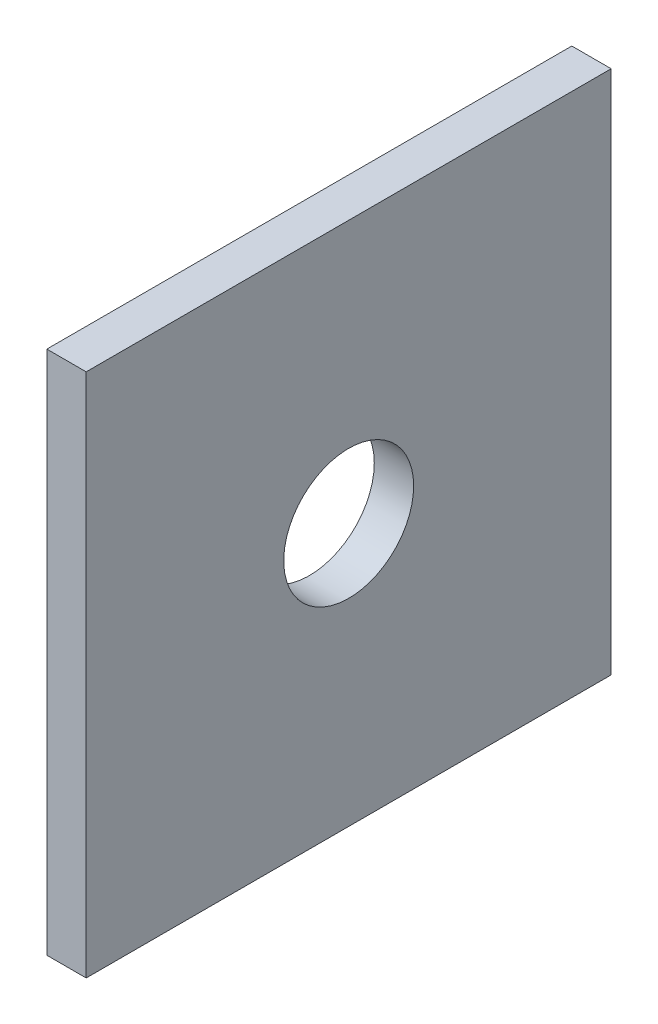
from build123d import *

# Parameters (mm, degrees)
SKETCH2_W           = 40
SKETCH2_H           = 40
BOSS_EXTRUDE1_DEPTH = 3
SKETCH3_R           = 4.95
CUT_EXTRUDE1_DEPTH  = 3


with BuildPart() as part:
    # Sketch2 → Boss-Extrude1 (new body)
    with BuildSketch(Plane(origin=(0, 0, 0), x_dir=(0, 0, -1), z_dir=(1, 0, 0))):
        Rectangle(SKETCH2_W, SKETCH2_H)
    extrude(amount=BOSS_EXTRUDE1_DEPTH)

    # Sketch3 → Cut-Extrude1 (cut)
    with BuildSketch(Plane(origin=(3, 0, 0), x_dir=(0, 0, -1), z_dir=(1, 0, 0))):
        Circle(SKETCH3_R)
    extrude(amount=-CUT_EXTRUDE1_DEPTH, mode=Mode.SUBTRACT)


solid = part.part
